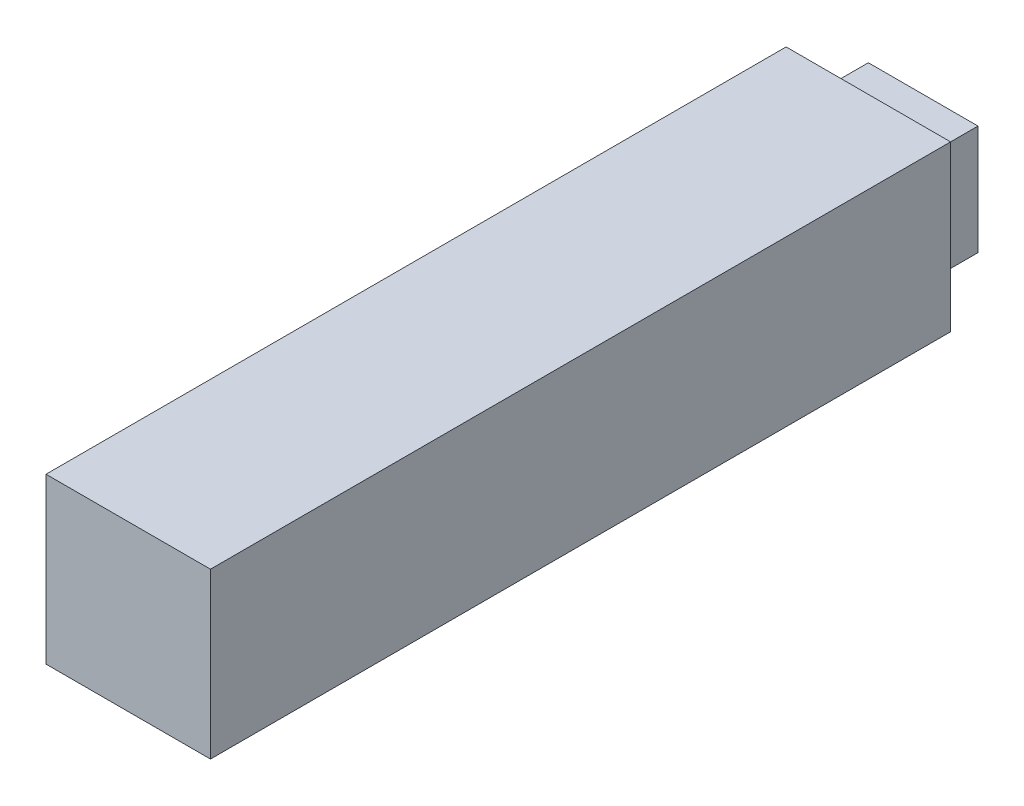
from build123d import *

# Parameters (mm, degrees)
SKETCH1_W           = 30
SKETCH1_H           = 30
BOSS_EXTRUDE1_DEPTH = 135
SKETCH2_W           = 20
SKETCH2_H           = 20
BOSS_EXTRUDE2_DEPTH = 10
SKETCH3_W           = 20.5
SKETCH3_H           = 20.5
CUT_EXTRUDE2_DEPTH  = 15
SKETCH4_W           = 20.5
SKETCH4_H           = 20.5
CUT_EXTRUDE4_DEPTH  = 15


with BuildPart() as part:
    # Sketch1 → Boss-Extrude1 (new body)
    with BuildSketch(Plane.XY):
        Rectangle(SKETCH1_W, SKETCH1_H)
    extrude(amount=BOSS_EXTRUDE1_DEPTH)

    # Sketch2 → Boss-Extrude2 (add)
    with BuildSketch(Plane.XY):
        Rectangle(SKETCH2_W, SKETCH2_H)
    extrude(amount=-BOSS_EXTRUDE2_DEPTH)

    # Sketch3 → Cut-Extrude2 (cut)
    with BuildSketch(Plane.ZY.offset(15)):
        with Locations((120, 0)):
            Rectangle(SKETCH3_W, SKETCH3_H)
    extrude(amount=-CUT_EXTRUDE2_DEPTH, mode=Mode.SUBTRACT)

    # Sketch4 → Cut-Extrude4 (cut)
    with BuildSketch(Plane.XZ.offset(15)):
        with Locations((0, 120)):
            Rectangle(SKETCH4_W, SKETCH4_H)
    extrude(amount=-CUT_EXTRUDE4_DEPTH, mode=Mode.SUBTRACT)


solid = part.part
